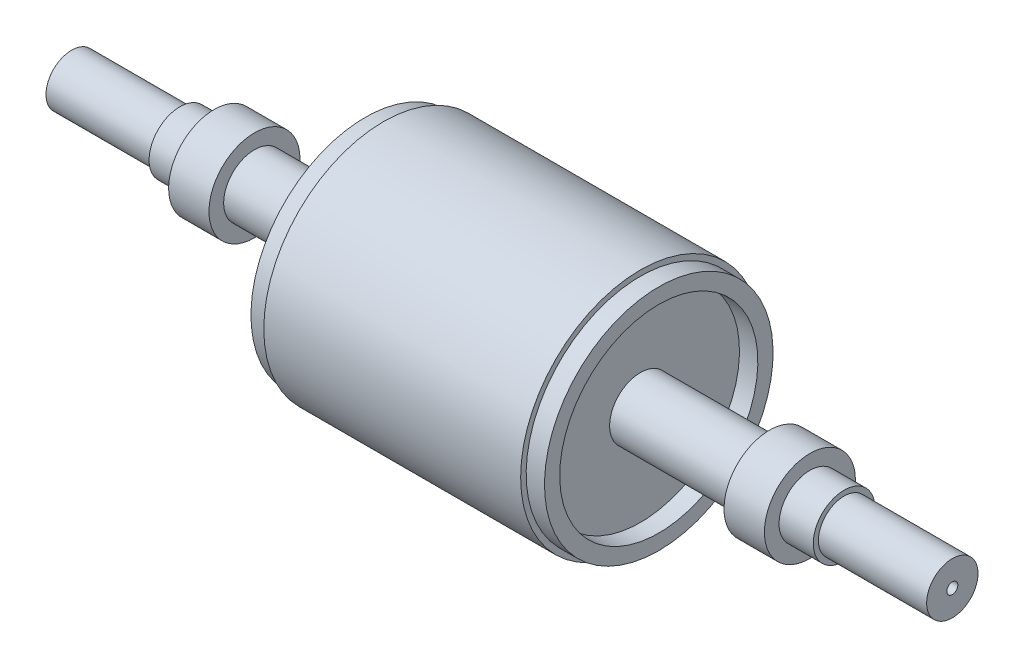
from build123d import *

# Parameters (mm, degrees)
CUT_EXTRUDE1_START = -5
SKETCH2_R          = 27
SKETCH2_R_2        = 8.4
CUT_EXTRUDE1_DEPTH = 5
SKETCH3_R          = 27
SKETCH3_R_2        = 8.4
CUT_EXTRUDE2_DEPTH = 5
SKETCH4_R          = 1.5
CUT_EXTRUDE3_DEPTH = 5
CUT_EXTRUDE4_START = -5
SKETCH6_R          = 1.5
CUT_EXTRUDE4_DEPTH = 5


with BuildPart() as part:
    # Sketch1 → Revolve1 (revolve)
    with BuildSketch(Plane.XY, mode=Mode.PRIVATE) as revolve1_sk:
        Polygon((136.652683421, -10.294425689), (136.652683421, -14.294425689), (145.975223156, -14.294425689), (145.975223156, -15.694425689), (175.475223156, -15.694425689), (175.475223156, -22.694425689), (-64.527316579, -22.694425689), (-64.527316579, -15.694425689), (-35.027316579, -15.694425689), (-35.027316579, -14.294425689), (-25.707316579, -14.294425689), (-25.707316579, -10.294425689), (-14.707316579, -10.294425689), (-14.707316579, -14.294425689), (15.472683421, -14.294425689), (15.472683421, 8.449285256), (20.472683421, 8.449285256), (20.472683421, 9.949285256), (90.472683421, 9.949285256), (90.475230364, 8.449287418), (95.475223156, 8.457777227), (95.475223156, -14.294425689), (125.652683421, -14.294425689), (125.652683421, -10.294425689), align=None)
    revolve(revolve1_sk.sketch.rotate(Axis((-64.527316579, -22.694425689, 0), (1, 0, 0)), 180), axis=Axis((-64.527316579, -22.694425689, 0), (1, 0, 0)))

    # Sketch2 → Cut-Extrude1 (cut)
    with BuildSketch(Plane.ZY.offset(-15.472683421).offset(CUT_EXTRUDE1_START)):
        with Locations(Location((0, -22.694425689, 0), (0, 0, 270))):
            Circle(SKETCH2_R)
        with Locations(Location((0, -22.694425689, 0), (0, 0, 270))):
            Circle(SKETCH2_R_2, mode=Mode.SUBTRACT)
    extrude(amount=CUT_EXTRUDE1_DEPTH, mode=Mode.SUBTRACT)

    # Sketch3 → Cut-Extrude2 (cut)
    with BuildSketch(Plane(origin=(95.475223156, 0, 0), x_dir=(0, 0, -1), z_dir=(1, 0, 0))):
        with Locations(Location((0, -22.694425689, 0), (0, 0, 270))):
            Circle(SKETCH3_R)
        with Locations(Location((0, -22.694425689, 0), (0, 0, 270))):
            Circle(SKETCH3_R_2, mode=Mode.SUBTRACT)
    extrude(amount=-CUT_EXTRUDE2_DEPTH, mode=Mode.SUBTRACT)

    # Sketch4 → Cut-Extrude3 (cut)
    with BuildSketch(Plane.ZY.offset(64.527316579)):
        with Locations(Location((0, -22.694425689, 0), (0, 0, 270))):
            Circle(SKETCH4_R)
    extrude(amount=-CUT_EXTRUDE3_DEPTH, mode=Mode.SUBTRACT)

    # Sketch6 → Cut-Extrude4 (cut)
    with BuildSketch(Plane(origin=(175.475223156, 0, 0), x_dir=(0, 0, -1), z_dir=(1, 0, 0)).offset(CUT_EXTRUDE4_START)):
        with Locations(Location((0, -22.694425689, 0), (0, 0, 270))):
            Circle(SKETCH6_R)
    extrude(amount=CUT_EXTRUDE4_DEPTH, mode=Mode.SUBTRACT)


solid = part.part
